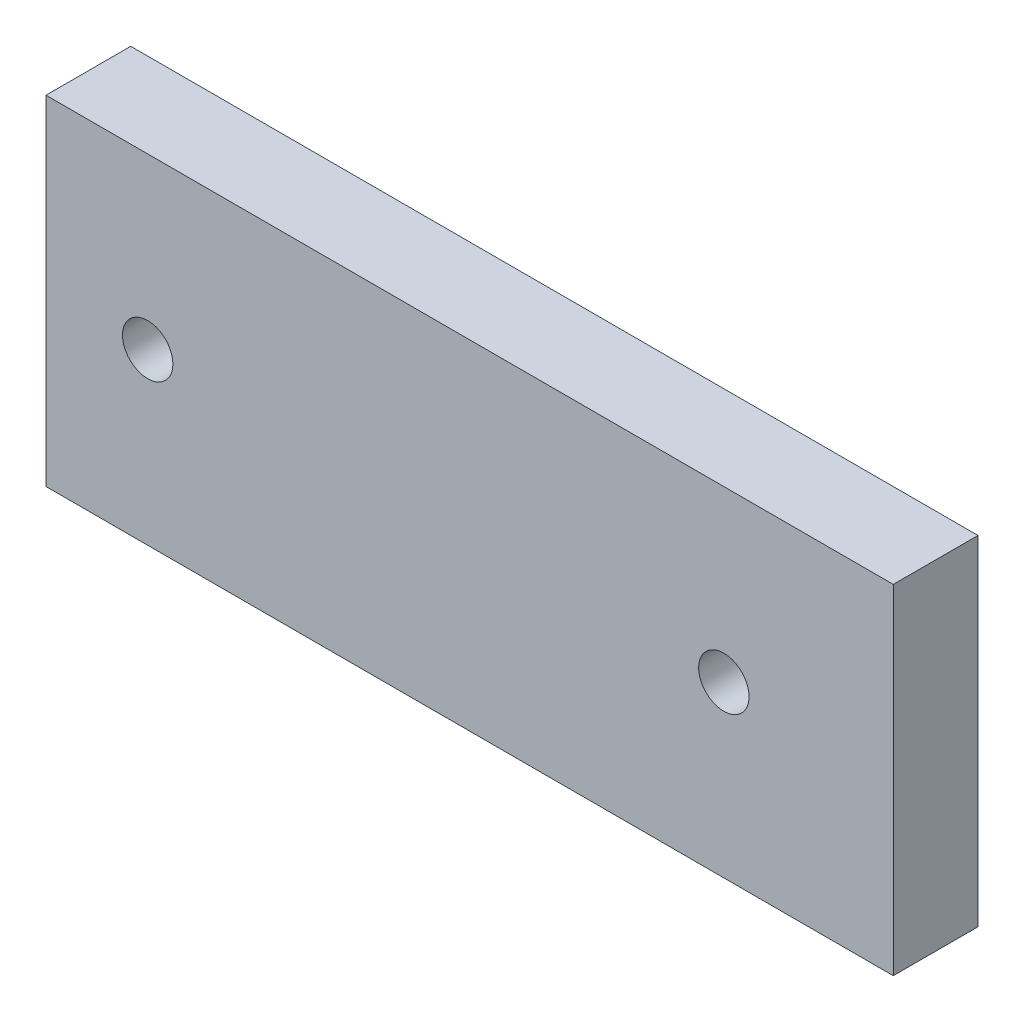
from build123d import *

# Parameters (mm, degrees)
SKETCH1_W           = 50
SKETCH1_H           = 20
SKETCH1_R           = 1.485736775
BOSS_EXTRUDE1_DEPTH = 5


with BuildPart() as part:
    # Sketch1 → Boss-Extrude1 (new body)
    with BuildSketch(Plane.XY):
        Rectangle(SKETCH1_W, SKETCH1_H)
        with Locations((-19, 0)):
            Circle(SKETCH1_R, mode=Mode.SUBTRACT)
        with Locations((15, 0)):
            Circle(SKETCH1_R, mode=Mode.SUBTRACT)
    extrude(amount=-BOSS_EXTRUDE1_DEPTH)


solid = part.part
